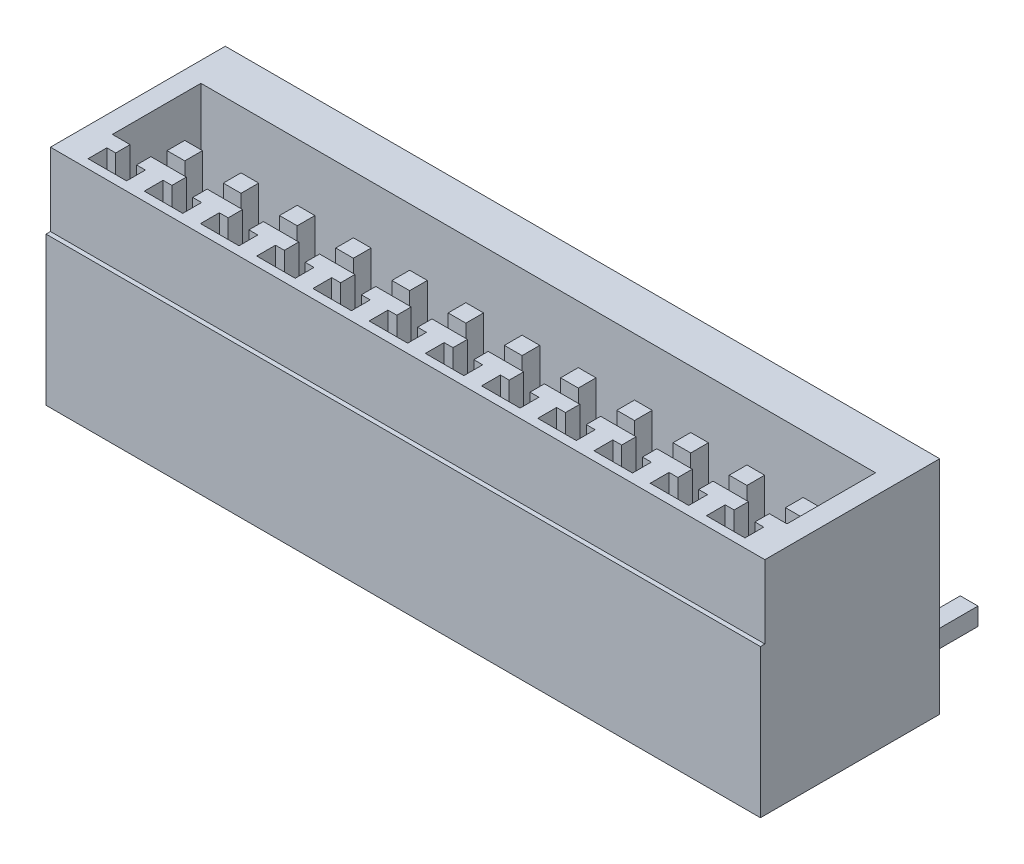
from build123d import *

# Parameters (mm, degrees)
SKETCH1_W           = 2.54
SKETCH1_H           = 10
BOSS_EXTRUDE1_DEPTH = 8.1
SKETCH1_3_W         = 0.8
SKETCH1_3_H         = 0.8
BOSS_EXTRUDE2_DEPTH = 3.5
SKETCH2_W           = 2.54
SKETCH2_H           = 3.3
CUT_EXTRUDE1_DEPTH  = 0.2
CUT_EXTRUDE2_DEPTH  = 6
SKETCH4_W           = 0.8
SKETCH4_H           = 0.8
BOSS_EXTRUDE3_DEPTH = 5
LPATTERN1_COUNT     = 12
LPATTERN1_PITCH     = 2.54
BOSS_EXTRUDE4_DEPTH = 0.9
BOSS_EXTRUDE5_START = -30.48
BOSS_EXTRUDE5_DEPTH = 0.9


with BuildPart() as part:
    # Sketch1 → Boss-Extrude1 (new body)
    with BuildSketch(Plane.XY):
        with Locations((13.97, 3.8)):
            Rectangle(SKETCH1_W, SKETCH1_H)
    extrude(amount=BOSS_EXTRUDE1_DEPTH)

    # Sketch1<3> → Boss-Extrude2 (add)
    with BuildSketch(Plane.XY):
        with Locations((13.97, 0)):
            Rectangle(SKETCH1_3_W, SKETCH1_3_H)
    extrude(amount=-BOSS_EXTRUDE2_DEPTH)

    # Sketch2 → Cut-Extrude1 (cut)
    with BuildSketch(Plane.XY.offset(8.1)):
        with Locations((13.97, 7.15)):
            Rectangle(SKETCH2_W, SKETCH2_H)
    extrude(amount=-CUT_EXTRUDE1_DEPTH, mode=Mode.SUBTRACT)

    # Sketch3 → Cut-Extrude2 (cut)
    with BuildSketch(Plane(origin=(0, 8.8, 0), x_dir=(1, 0, 0), z_dir=(0, 1, 0))):
        Polygon((15.24, -2), (12.7, -2), (12.7, -6), (13.5, -6), (13.5, -6.65), (13.1, -6.65), (13.1, -7.5), (14.84, -7.5), (14.84, -6.65), (14.44, -6.65), (14.44, -6), (15.24, -6), align=None)
    extrude(amount=-CUT_EXTRUDE2_DEPTH, mode=Mode.SUBTRACT)

    # Sketch4 → Boss-Extrude3 (add)
    with BuildSketch(Plane(origin=(0, 2.8, 0), x_dir=(1, 0, 0), z_dir=(0, 1, 0))):
        with Locations((13.97, -4)):
            Rectangle(SKETCH4_W, SKETCH4_H)
    extrude(amount=BOSS_EXTRUDE3_DEPTH)


with BuildPart() as lpattern1_1:
    # LPattern1: pattern copy
    add(part.part.moved(Location(Vector(-1, 0, 0) * (1 * LPATTERN1_PITCH))))


with BuildPart() as lpattern1_2:
    # LPattern1: pattern copy
    add(part.part.moved(Location(Vector(-1, 0, 0) * (2 * LPATTERN1_PITCH))))


with BuildPart() as lpattern1_3:
    # LPattern1: pattern copy
    add(part.part.moved(Location(Vector(-1, 0, 0) * (3 * LPATTERN1_PITCH))))


with BuildPart() as lpattern1_4:
    # LPattern1: pattern copy
    add(part.part.moved(Location(Vector(-1, 0, 0) * (4 * LPATTERN1_PITCH))))


with BuildPart() as lpattern1_5:
    # LPattern1: pattern copy
    add(part.part.moved(Location(Vector(-1, 0, 0) * (5 * LPATTERN1_PITCH))))


with BuildPart() as lpattern1_6:
    # LPattern1: pattern copy
    add(part.part.moved(Location(Vector(-1, 0, 0) * (6 * LPATTERN1_PITCH))))


with BuildPart() as lpattern1_7:
    # LPattern1: pattern copy
    add(part.part.moved(Location(Vector(-1, 0, 0) * (7 * LPATTERN1_PITCH))))


with BuildPart() as lpattern1_8:
    # LPattern1: pattern copy
    add(part.part.moved(Location(Vector(-1, 0, 0) * (8 * LPATTERN1_PITCH))))


with BuildPart() as lpattern1_9:
    # LPattern1: pattern copy
    add(part.part.moved(Location(Vector(-1, 0, 0) * (9 * LPATTERN1_PITCH))))


with BuildPart() as lpattern1_10:
    # LPattern1: pattern copy
    add(part.part.moved(Location(Vector(-1, 0, 0) * (10 * LPATTERN1_PITCH))))


with BuildPart() as lpattern1_11:
    # LPattern1: pattern copy
    add(part.part.moved(Location(Vector(-1, 0, 0) * (11 * LPATTERN1_PITCH))))


with BuildPart() as part_1:
    add(part.part)

    # Sketch5 → Boss-Extrude4 (add)
    with BuildSketch(Plane(origin=(15.24, 0, 0), x_dir=(0, 0, -1), z_dir=(1, 0, 0))):
        Polygon((-8.1, -1.2), (0, -1.2), (0, 8.8), (-7.9, 8.8), (-7.9, 5.5), (-8.1, 5.5), align=None)
    extrude(amount=BOSS_EXTRUDE4_DEPTH)


with BuildPart() as body_13:
    # Sketch5<2> → Boss-Extrude5 (new body)
    with BuildSketch(Plane(origin=(15.24, 0, 0), x_dir=(0, 0, -1), z_dir=(1, 0, 0)).offset(BOSS_EXTRUDE5_START)):
        Polygon((-8.1, -1.2), (0, -1.2), (0, 8.8), (-7.9, 8.8), (-7.9, 5.5), (-8.1, 5.5), align=None)
    extrude(amount=-BOSS_EXTRUDE5_DEPTH)


with BuildPart() as lpattern1_1_1:
    add(lpattern1_1.part)

    # Combine1: union LPattern1_2, LPattern1_3, LPattern1_4, LPattern1_5, LPattern1_6, LPattern1_7, LPattern1_8, LPattern1_9, LPattern1_10, LPattern1_11, part, body 13
    add(lpattern1_2.part)
    add(lpattern1_3.part)
    add(lpattern1_4.part)
    add(lpattern1_5.part)
    add(lpattern1_6.part)
    add(lpattern1_7.part)
    add(lpattern1_8.part)
    add(lpattern1_9.part)
    add(lpattern1_10.part)
    add(lpattern1_11.part)
    add(part_1.part)
    add(body_13.part)


solid = lpattern1_1_1.part
